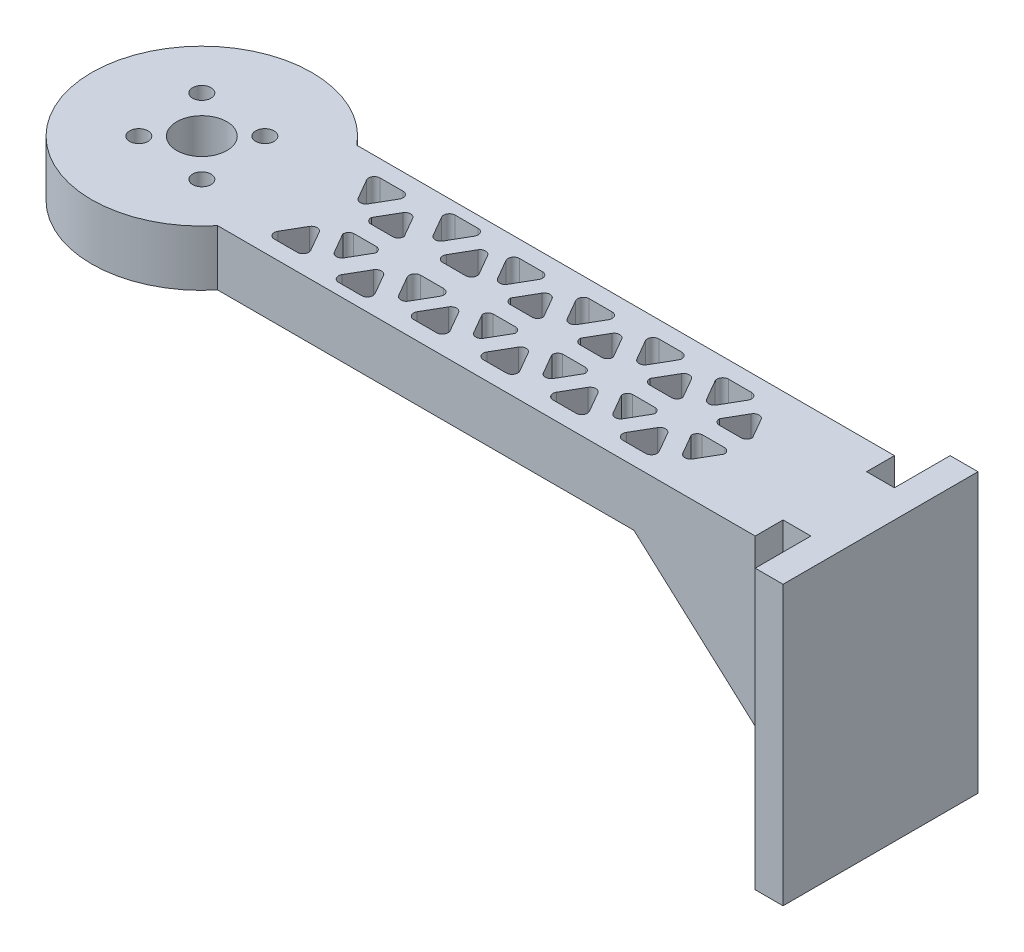
from build123d import *

# Parameters (mm, degrees)
SKETCH1_R           = 1.65
SKETCH1_R_2         = 4.5
BOSS_EXTRUDE2_DEPTH = 10
BOSS_EXTRUDE3_DEPTH = 50
BOSS_EXTRUDE4_REACH = 134.247
CUT_EXTRUDE1_REACH  = 135.185
SKETCH2_3_W         = 5
SKETCH2_3_H         = 5


with BuildPart() as part:
    # Sketch1 → Boss-Extrude2 (new body)
    with BuildSketch(Plane(origin=(0, 0, 0), x_dir=(1, 0, 0), z_dir=(0, 1, 0))):
        with BuildLine():
            Line((121.848372292, 12.5), (15.332022575, 12.5))
            ThreePointArc((15.332022575, 12.5), (-19.781832985, 0), (15.332022575, -12.5))
            Line((15.332022575, -12.5), (121.848372292, -12.5))
            Line((121.848372292, -12.5), (121.848372292, 12.5))
        make_face()
        with BuildLine():
            Line((27.867718097, 2.564364072), (29.934981691, 6.142673887))
            ThreePointArc((29.934981691, 6.142673887), (30.821593952, 6.654395547), (31.708206213, 6.142673887))
            Line((31.708206213, 6.142673887), (33.775469807, 2.556516089))
            ThreePointArc((33.775469807, 2.556516089), (33.536731527, 1.85658781), (32.888857546, 1.5))
            Line((32.888857546, 1.5), (28.754330358, 1.5))
            ThreePointArc((28.754330358, 1.5), (28.103716588, 1.859495358), (27.867718097, 2.564364072))
        make_face(mode=Mode.SUBTRACT)
        with BuildLine():
            ThreePointArc((46.281498727, 3.523632181), (46.287424275, 2.493670166), (45.394886466, 1.979634055))
            Line((45.394886466, 1.979634055), (41.260359278, 1.979634055))
            ThreePointArc((41.260359278, 1.979634055), (40.373776505, 2.491304676), (40.373261616, 3.514943076))
            Line((40.373261616, 3.514943076), (42.441010611, 7.101941997))
            ThreePointArc((42.441010611, 7.101941997), (43.327622872, 7.613663657), (44.214235133, 7.101941997))
            Line((44.214235133, 7.101941997), (46.281498727, 3.523632181))
        make_face(mode=Mode.SUBTRACT)
        with BuildLine():
            ThreePointArc((21.614703637, 7.963849857), (21.6144903, 8.987908889), (22.501315898, 9.5))
            Line((22.501315898, 9.5), (26.635843086, 9.5))
            ThreePointArc((26.635843086, 9.5), (27.522668684, 8.987908889), (27.522455347, 7.963849857))
            Line((27.522455347, 7.963849857), (25.455191753, 4.385540041))
            ThreePointArc((25.455191753, 4.385540041), (24.568579492, 3.873818381), (23.681967231, 4.385540041))
            Line((23.681967231, 4.385540041), (21.614703637, 7.963849857))
        make_face(mode=Mode.SUBTRACT)
        with BuildLine():
            ThreePointArc((39.141872006, 10.459268109), (40.028697604, 9.947176998), (40.028484267, 8.923117966))
            Line((40.028484267, 8.923117966), (37.961220673, 5.34480815))
            ThreePointArc((37.961220673, 5.34480815), (37.074608412, 4.833086491), (36.187996151, 5.34480815))
            Line((36.187996151, 5.34480815), (34.120732557, 8.923117966))
            ThreePointArc((34.120732557, 8.923117966), (34.12051922, 9.947176998), (35.007344818, 10.459268109))
            Line((35.007344818, 10.459268109), (39.141872006, 10.459268109))
        make_face(mode=Mode.SUBTRACT)
        with BuildLine():
            ThreePointArc((46.634703637, 7.963849857), (46.6344903, 8.987908889), (47.521315898, 9.5))
            Line((47.521315898, 9.5), (51.655843086, 9.5))
            ThreePointArc((51.655843086, 9.5), (52.542668684, 8.987908889), (52.542455347, 7.963849857))
            Line((52.542455347, 7.963849857), (50.475191753, 4.385540041))
            ThreePointArc((50.475191753, 4.385540041), (49.588579492, 3.873818381), (48.701967231, 4.385540041))
            Line((48.701967231, 4.385540041), (46.634703637, 7.963849857))
        make_face(mode=Mode.SUBTRACT)
        with BuildLine():
            Line((52.887718097, 2.564364072), (54.954981691, 6.142673887))
            ThreePointArc((54.954981691, 6.142673887), (55.841593952, 6.654395547), (56.728206213, 6.142673887))
            Line((56.728206213, 6.142673887), (58.795469807, 2.556516089))
            ThreePointArc((58.795469807, 2.556516089), (58.556731527, 1.85658781), (57.908857546, 1.5))
            Line((57.908857546, 1.5), (53.774330358, 1.5))
            ThreePointArc((53.774330358, 1.5), (53.123716588, 1.859495358), (52.887718097, 2.564364072))
        make_face(mode=Mode.SUBTRACT)
        with BuildLine():
            Line((65.397718097, 2.564364072), (67.464981691, 6.142673887))
            ThreePointArc((67.464981691, 6.142673887), (68.351593952, 6.654395547), (69.238206213, 6.142673887))
            Line((69.238206213, 6.142673887), (71.305469807, 2.556516089))
            ThreePointArc((71.305469807, 2.556516089), (71.066731527, 1.85658781), (70.418857546, 1.5))
            Line((70.418857546, 1.5), (66.284330358, 1.5))
            ThreePointArc((66.284330358, 1.5), (65.633716588, 1.859495358), (65.397718097, 2.564364072))
        make_face(mode=Mode.SUBTRACT)
        with BuildLine():
            Line((77.907718097, 2.564364072), (79.974981691, 6.142673887))
            ThreePointArc((79.974981691, 6.142673887), (80.861593952, 6.654395547), (81.748206213, 6.142673887))
            Line((81.748206213, 6.142673887), (83.815469807, 2.556516089))
            ThreePointArc((83.815469807, 2.556516089), (83.576731527, 1.85658781), (82.928857546, 1.5))
            Line((82.928857546, 1.5), (78.794330358, 1.5))
            ThreePointArc((78.794330358, 1.5), (78.143716588, 1.859495358), (77.907718097, 2.564364072))
        make_face(mode=Mode.SUBTRACT)
        with BuildLine():
            ThreePointArc((59.144703637, 7.963849857), (59.1444903, 8.987908889), (60.031315898, 9.5))
            Line((60.031315898, 9.5), (64.165843086, 9.5))
            ThreePointArc((64.165843086, 9.5), (65.052668684, 8.987908889), (65.052455347, 7.963849857))
            Line((65.052455347, 7.963849857), (62.985191753, 4.385540041))
            ThreePointArc((62.985191753, 4.385540041), (62.098579492, 3.873818381), (61.211967231, 4.385540041))
            Line((61.211967231, 4.385540041), (59.144703637, 7.963849857))
        make_face(mode=Mode.SUBTRACT)
        with BuildLine():
            ThreePointArc((71.654703637, 7.963849857), (71.6544903, 8.987908889), (72.541315898, 9.5))
            Line((72.541315898, 9.5), (76.675843086, 9.5))
            ThreePointArc((76.675843086, 9.5), (77.562668684, 8.987908889), (77.562455347, 7.963849857))
            Line((77.562455347, 7.963849857), (75.495191753, 4.385540041))
            ThreePointArc((75.495191753, 4.385540041), (74.608579492, 3.873818381), (73.721967231, 4.385540041))
            Line((73.721967231, 4.385540041), (71.654703637, 7.963849857))
        make_face(mode=Mode.SUBTRACT)
        with BuildLine():
            Line((90.417718097, 2.564364072), (92.484981691, 6.142673887))
            ThreePointArc((92.484981691, 6.142673887), (93.371593952, 6.654395547), (94.258206213, 6.142673887))
            Line((94.258206213, 6.142673887), (96.325469807, 2.556516089))
            ThreePointArc((96.325469807, 2.556516089), (96.086731527, 1.85658781), (95.438857546, 1.5))
            Line((95.438857546, 1.5), (91.304330358, 1.5))
            ThreePointArc((91.304330358, 1.5), (90.653716588, 1.859495358), (90.417718097, 2.564364072))
        make_face(mode=Mode.SUBTRACT)
        with BuildLine():
            ThreePointArc((84.164703637, 7.963849857), (84.1644903, 8.987908889), (85.051315898, 9.5))
            Line((85.051315898, 9.5), (89.185843086, 9.5))
            ThreePointArc((89.185843086, 9.5), (90.072668684, 8.987908889), (90.072455347, 7.963849857))
            Line((90.072455347, 7.963849857), (88.005191753, 4.385540041))
            ThreePointArc((88.005191753, 4.385540041), (87.118579492, 3.873818381), (86.231967231, 4.385540041))
            Line((86.231967231, 4.385540041), (84.164703637, 7.963849857))
        make_face(mode=Mode.SUBTRACT)
        with Locations(Location((5.656854249, 5.656854249, 0), (0, 0, 270))):
            Circle(SKETCH1_R, mode=Mode.SUBTRACT)
        with Locations(Location((-5.656854249, -5.656854249, 0), (0, 0, 270))):
            Circle(SKETCH1_R, mode=Mode.SUBTRACT)
        with Locations(Location((6.717514421, -6.717514421, 0), (0, 0, 270))):
            Circle(SKETCH1_R, mode=Mode.SUBTRACT)
        with Locations(Location((0, 0, 0), (0, 0, 270))):
            Circle(SKETCH1_R_2, mode=Mode.SUBTRACT)
        with Locations(Location((-6.717514421, 6.717514421, 0), (0, 0, 270))):
            Circle(SKETCH1_R, mode=Mode.SUBTRACT)
        with BuildLine():
            ThreePointArc((95.438857546, -1.5), (96.086731527, -1.85658781), (96.325469807, -2.556516089))
            Line((96.325469807, -2.556516089), (94.258206213, -6.142673887))
            ThreePointArc((94.258206213, -6.142673887), (93.371593952, -6.654395547), (92.484981691, -6.142673887))
            Line((92.484981691, -6.142673887), (90.417718097, -2.564364072))
            ThreePointArc((90.417718097, -2.564364072), (90.653716588, -1.859495358), (91.304330358, -1.5))
            Line((91.304330358, -1.5), (95.438857546, -1.5))
        make_face(mode=Mode.SUBTRACT)
        with BuildLine():
            Line((21.614703637, -7.963849857), (23.681967231, -4.385540041))
            ThreePointArc((23.681967231, -4.385540041), (24.568579492, -3.873818381), (25.455191753, -4.385540041))
            Line((25.455191753, -4.385540041), (27.522455347, -7.963849857))
            ThreePointArc((27.522455347, -7.963849857), (27.522668684, -8.987908889), (26.635843086, -9.5))
            Line((26.635843086, -9.5), (22.501315898, -9.5))
            ThreePointArc((22.501315898, -9.5), (21.6144903, -8.987908889), (21.614703637, -7.963849857))
        make_face(mode=Mode.SUBTRACT)
        with BuildLine():
            ThreePointArc((40.028484267, -8.923117966), (40.028697604, -9.947176998), (39.141872006, -10.459268109))
            Line((39.141872006, -10.459268109), (35.007344818, -10.459268109))
            ThreePointArc((35.007344818, -10.459268109), (34.12051922, -9.947176998), (34.120732557, -8.923117966))
            Line((34.120732557, -8.923117966), (36.187996151, -5.34480815))
            ThreePointArc((36.187996151, -5.34480815), (37.074608412, -4.833086491), (37.961220673, -5.34480815))
            Line((37.961220673, -5.34480815), (40.028484267, -8.923117966))
        make_face(mode=Mode.SUBTRACT)
        with BuildLine():
            Line((46.634703637, -7.963849857), (48.701967231, -4.385540041))
            ThreePointArc((48.701967231, -4.385540041), (49.588579492, -3.873818381), (50.475191753, -4.385540041))
            Line((50.475191753, -4.385540041), (52.542455347, -7.963849857))
            ThreePointArc((52.542455347, -7.963849857), (52.542668684, -8.987908889), (51.655843086, -9.5))
            Line((51.655843086, -9.5), (47.521315898, -9.5))
            ThreePointArc((47.521315898, -9.5), (46.6344903, -8.987908889), (46.634703637, -7.963849857))
        make_face(mode=Mode.SUBTRACT)
        with BuildLine():
            ThreePointArc((27.867718097, -2.564364072), (28.103716588, -1.859495358), (28.754330358, -1.5))
            Line((28.754330358, -1.5), (32.888857546, -1.5))
            ThreePointArc((32.888857546, -1.5), (33.536731527, -1.85658781), (33.775469807, -2.556516089))
            Line((33.775469807, -2.556516089), (31.708206213, -6.142673887))
            ThreePointArc((31.708206213, -6.142673887), (30.821593952, -6.654395547), (29.934981691, -6.142673887))
            Line((29.934981691, -6.142673887), (27.867718097, -2.564364072))
        make_face(mode=Mode.SUBTRACT)
        with BuildLine():
            Line((46.281498727, -3.523632181), (44.214235133, -7.101941997))
            ThreePointArc((44.214235133, -7.101941997), (43.327622872, -7.613663657), (42.441010611, -7.101941997))
            Line((42.441010611, -7.101941997), (40.373261616, -3.514943076))
            ThreePointArc((40.373261616, -3.514943076), (40.373776505, -2.491304676), (41.260359278, -1.979634055))
            Line((41.260359278, -1.979634055), (45.394886466, -1.979634055))
            ThreePointArc((45.394886466, -1.979634055), (46.287424275, -2.493670166), (46.281498727, -3.523632181))
        make_face(mode=Mode.SUBTRACT)
        with BuildLine():
            Line((59.144703637, -7.963849857), (61.211967231, -4.385540041))
            ThreePointArc((61.211967231, -4.385540041), (62.098579492, -3.873818381), (62.985191753, -4.385540041))
            Line((62.985191753, -4.385540041), (65.052455347, -7.963849857))
            ThreePointArc((65.052455347, -7.963849857), (65.052668684, -8.987908889), (64.165843086, -9.5))
            Line((64.165843086, -9.5), (60.031315898, -9.5))
            ThreePointArc((60.031315898, -9.5), (59.1444903, -8.987908889), (59.144703637, -7.963849857))
        make_face(mode=Mode.SUBTRACT)
        with BuildLine():
            Line((71.654703637, -7.963849857), (73.721967231, -4.385540041))
            ThreePointArc((73.721967231, -4.385540041), (74.608579492, -3.873818381), (75.495191753, -4.385540041))
            Line((75.495191753, -4.385540041), (77.562455347, -7.963849857))
            ThreePointArc((77.562455347, -7.963849857), (77.562668684, -8.987908889), (76.675843086, -9.5))
            Line((76.675843086, -9.5), (72.541315898, -9.5))
            ThreePointArc((72.541315898, -9.5), (71.6544903, -8.987908889), (71.654703637, -7.963849857))
        make_face(mode=Mode.SUBTRACT)
        with BuildLine():
            ThreePointArc((52.887718097, -2.564364072), (53.123716588, -1.859495358), (53.774330358, -1.5))
            Line((53.774330358, -1.5), (57.908857546, -1.5))
            ThreePointArc((57.908857546, -1.5), (58.556731527, -1.85658781), (58.795469807, -2.556516089))
            Line((58.795469807, -2.556516089), (56.728206213, -6.142673887))
            ThreePointArc((56.728206213, -6.142673887), (55.841593952, -6.654395547), (54.954981691, -6.142673887))
            Line((54.954981691, -6.142673887), (52.887718097, -2.564364072))
        make_face(mode=Mode.SUBTRACT)
        with BuildLine():
            ThreePointArc((65.397718097, -2.564364072), (65.633716588, -1.859495358), (66.284330358, -1.5))
            Line((66.284330358, -1.5), (70.418857546, -1.5))
            ThreePointArc((70.418857546, -1.5), (71.066731527, -1.85658781), (71.305469807, -2.556516089))
            Line((71.305469807, -2.556516089), (69.238206213, -6.142673887))
            ThreePointArc((69.238206213, -6.142673887), (68.351593952, -6.654395547), (67.464981691, -6.142673887))
            Line((67.464981691, -6.142673887), (65.397718097, -2.564364072))
        make_face(mode=Mode.SUBTRACT)
        with BuildLine():
            ThreePointArc((77.907718097, -2.564364072), (78.143716588, -1.859495358), (78.794330358, -1.5))
            Line((78.794330358, -1.5), (82.928857546, -1.5))
            ThreePointArc((82.928857546, -1.5), (83.576731527, -1.85658781), (83.815469807, -2.556516089))
            Line((83.815469807, -2.556516089), (81.748206213, -6.142673887))
            ThreePointArc((81.748206213, -6.142673887), (80.861593952, -6.654395547), (79.974981691, -6.142673887))
            Line((79.974981691, -6.142673887), (77.907718097, -2.564364072))
        make_face(mode=Mode.SUBTRACT)
        with BuildLine():
            Line((84.164703637, -7.963849857), (86.231967231, -4.385540041))
            ThreePointArc((86.231967231, -4.385540041), (87.118579492, -3.873818381), (88.005191753, -4.385540041))
            Line((88.005191753, -4.385540041), (90.072455347, -7.963849857))
            ThreePointArc((90.072455347, -7.963849857), (90.072668684, -8.987908889), (89.185843086, -9.5))
            Line((89.185843086, -9.5), (85.051315898, -9.5))
            ThreePointArc((85.051315898, -9.5), (84.1644903, -8.987908889), (84.164703637, -7.963849857))
        make_face(mode=Mode.SUBTRACT)
    extrude(amount=BOSS_EXTRUDE2_DEPTH)

    # Sketch2 → Boss-Extrude3 (add)
    with BuildSketch(Plane(origin=(0, 10, 0), x_dir=(1, 0, 0), z_dir=(0, 1, 0))):
        Polygon((121.848372292, 12.5), (121.848372292, 17.5), (116.848372292, 17.5), (116.848372292, 12.5), (116.848372292, -12.5), (116.848372292, -17.5), (121.848372292, -17.5), (121.848372292, -12.5), align=None)
    extrude(amount=-BOSS_EXTRUDE3_DEPTH)

    # Boss-Extrude4: up to this face of the body (flat: up to its plane)
    boss_extrude4_end = Plane(part.part.faces().sort_by_distance((66.090197433, 5, -12.5))[0])
    # Sketch3 → Boss-Extrude4 (add, up to the picked face)
    with BuildSketch(Plane.XY.offset(12.5), mode=Mode.PRIVATE) as boss_extrude4_sk1:
        Polygon((90.072455347, 0), (116.848372292, -24.081106476), (116.848372292, 0), align=None)
    boss_extrude4_tool1 = split(extrude(boss_extrude4_sk1.sketch, amount=-BOSS_EXTRUDE4_REACH, mode=Mode.PRIVATE), bisect_by=boss_extrude4_end, keep=Keep.BOTH, mode=Mode.PRIVATE)
    add(boss_extrude4_tool1.solids().sort_by(Axis((107.923067, -8.027035, 12.5), (0, 0, -1)))[0])

    # Cut-Extrude1: up to this plane
    cut_extrude1_end = Plane(origin=(90.072455347, 0, -48.51179553), z_dir=(-0.6687005221736984, -0.7435318497849458, 0))
    # Sketch2<3> → Cut-Extrude1 (cut, up to the surface)
    with BuildSketch(Plane(origin=(0, 10, 0), x_dir=(1, 0, 0), z_dir=(0, 1, 0)), mode=Mode.PRIVATE) as cut_extrude1_sk1:
        with Locations((114.348372292, 10)):
            Rectangle(SKETCH2_3_W, SKETCH2_3_H)
    cut_extrude1_tool1 = split(extrude(cut_extrude1_sk1.sketch, amount=-CUT_EXTRUDE1_REACH, mode=Mode.PRIVATE), bisect_by=cut_extrude1_end, keep=Keep.BOTH, mode=Mode.PRIVATE)
    add(cut_extrude1_tool1.solids().sort_by_distance((114.348372, 10, -10))[0], mode=Mode.SUBTRACT)
    # Sketch2<3> → Cut-Extrude1 (cut, up to the surface)
    with BuildSketch(Plane(origin=(0, 10, 0), x_dir=(1, 0, 0), z_dir=(0, 1, 0)), mode=Mode.PRIVATE) as cut_extrude1_sk2:
        with Locations((114.348372292, -10)):
            Rectangle(SKETCH2_3_W, SKETCH2_3_H)
    cut_extrude1_tool2 = split(extrude(cut_extrude1_sk2.sketch, amount=-CUT_EXTRUDE1_REACH, mode=Mode.PRIVATE), bisect_by=cut_extrude1_end, keep=Keep.BOTH, mode=Mode.PRIVATE)
    add(cut_extrude1_tool2.solids().sort_by_distance((114.348372, 10, 10))[0], mode=Mode.SUBTRACT)


solid = part.part
